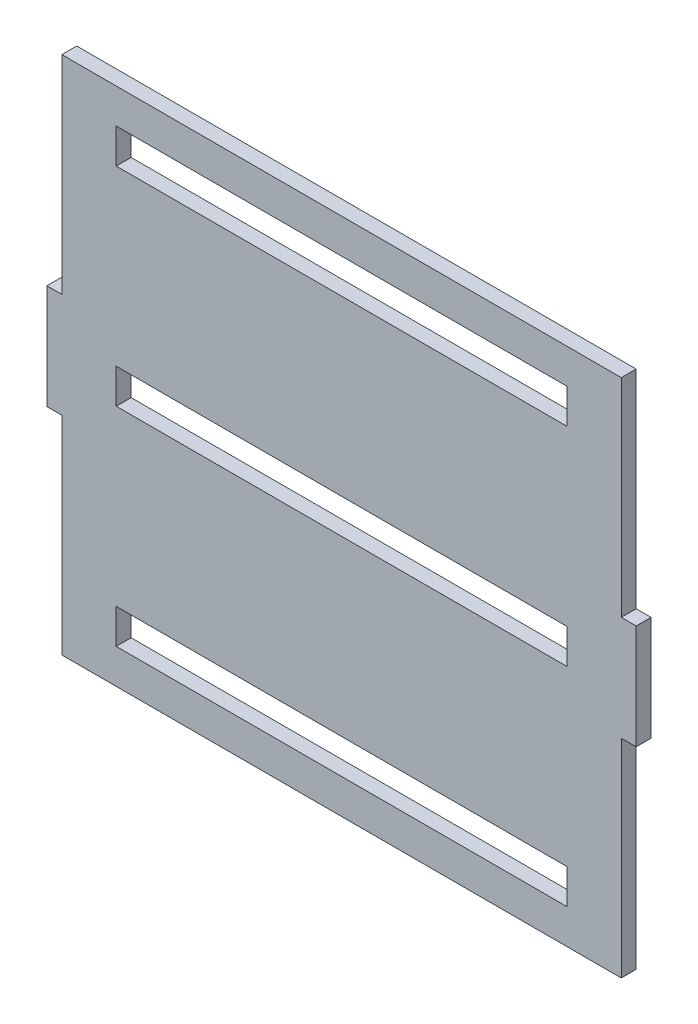
from build123d import *

# Parameters (mm, degrees)
SKETCH1_W           = 130
SKETCH1_H           = 10
BOSS_EXTRUDE1_DEPTH = 4.3


with BuildPart() as part:
    # Sketch1 → Boss-Extrude1 (new body)
    with BuildSketch(Plane.XY):
        Polygon((80.7, 15.1), (80.7, 75), (-80.7, 75), (-80.7, 15.1), (-85, 15.1), (-85, -15.1), (-80.7, -15.1), (-80.7, -75), (80.7, -75), (80.7, -15.1), (85, -15.1), (85, 15.1), align=None)
        with Locations((0, 60)):
            Rectangle(SKETCH1_W, SKETCH1_H, mode=Mode.SUBTRACT)
        Rectangle(SKETCH1_W, SKETCH1_H, mode=Mode.SUBTRACT)
        with Locations((0, -60)):
            Rectangle(SKETCH1_W, SKETCH1_H, mode=Mode.SUBTRACT)
    extrude(amount=BOSS_EXTRUDE1_DEPTH)


solid = part.part
